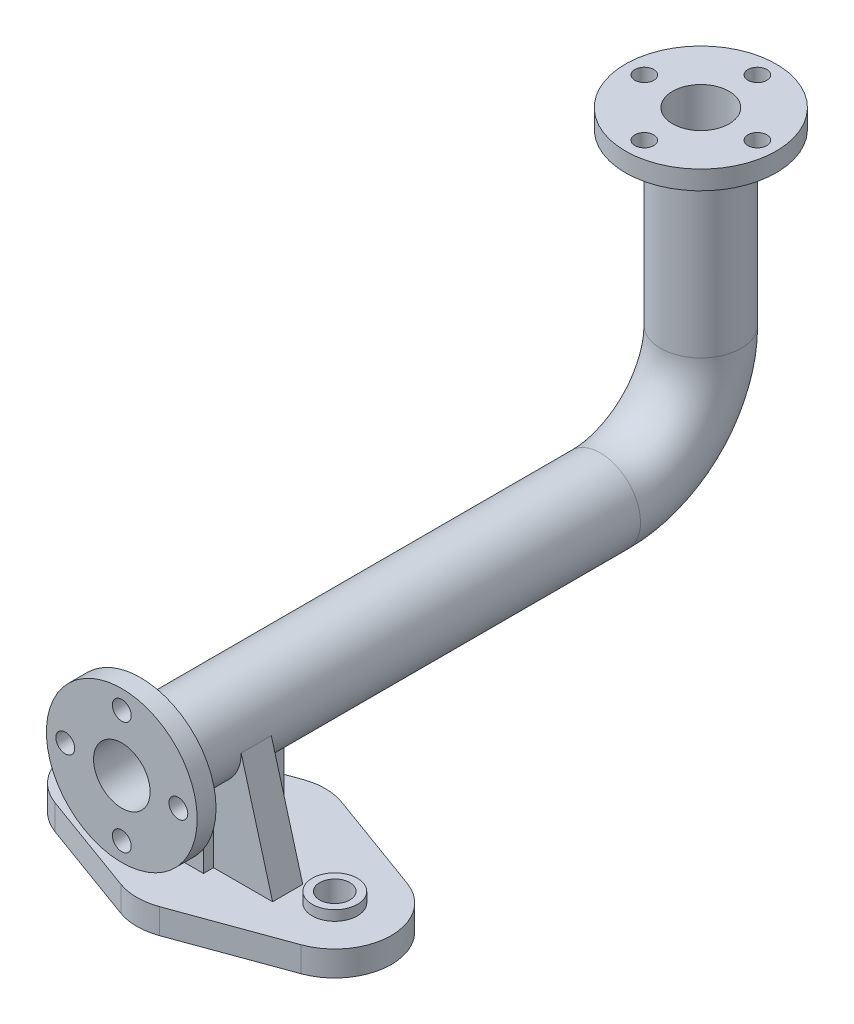
from build123d import *
from build123d.topology import SkipClean

# Parameters (mm, degrees)
SWEEP_THIN1_PROFILE_R   = 32
SWEEP_THIN1_PROFILE_R_2 = 22.5
SKETCH16_R              = 60
SKETCH16_R_2            = 7.5
SKETCH16_R_3            = 22.5
BOSS_EXTRUDE1_DEPTH     = 15
BOSS_EXTRUDE2_START     = 15
SKETCH17_R              = 60
SKETCH17_R_2            = 22.5
SKETCH17_R_3            = 7.5
BOSS_EXTRUDE2_DEPTH     = 15
SKETCH24_R              = 12
BOSS_EXTRUDE3_DEPTH     = 20
EXTRUDE_THIN1_REACH     = 577.336
SKETCH26_W              = 20
SKETCH26_H              = 64
RIB1_REACH              = 568.248
SKETCH27_WALL_W         = 1227.903575826
SKETCH27_WALL_H         = 24
SKETCH28_R              = 18
SKETCH28_R_2            = 12
BOSS_EXTRUDE4_DEPTH     = 8


with BuildPart() as part:
    # Sweep-Thin1: sweep along a path in Sketch1
    with BuildLine(Plane(origin=(0, 0, 0), x_dir=(0, 0, -1), z_dir=(1, 0, 0))) as sweep_thin1_path:
        Line((0, 0), (0, -135))
        ThreePointArc((0, -135), (-23.431457505, -191.568542495), (-80, -215))
        Line((-80, -215), (-445.82, -215))
    # Sweep-Thin1 profile (on start of the path) → Sweep-Thin1 (sweep)
    with BuildSketch(Plane(origin=(0, 0, 0), x_dir=(0, 0, -1), z_dir=(0, -1, 0))):
        Circle(SWEEP_THIN1_PROFILE_R)
        Circle(SWEEP_THIN1_PROFILE_R_2, mode=Mode.SUBTRACT)
    sweep(path=sweep_thin1_path.line)

    # Sketch16 → Boss-Extrude1 (add)
    with SkipClean():  # the faces are left unmerged after this step: merging them gives an invalid solid
        with BuildSketch(Plane(origin=(0, 0, 0), x_dir=(1, 0, 0), z_dir=(0, 1, 0))):
            Circle(SKETCH16_R)
            with Locations((0, -45)):
                Circle(SKETCH16_R_2, mode=Mode.SUBTRACT)
            with Locations((-45, 0)):
                Circle(SKETCH16_R_2, mode=Mode.SUBTRACT)
            with Locations((0, 45)):
                Circle(SKETCH16_R_2, mode=Mode.SUBTRACT)
            with Locations((45, 0)):
                Circle(SKETCH16_R_2, mode=Mode.SUBTRACT)
            Circle(SKETCH16_R_3, mode=Mode.SUBTRACT)
        extrude(amount=BOSS_EXTRUDE1_DEPTH)

    # Sketch17 → Boss-Extrude2 (add)
    with SkipClean():  # the faces are left unmerged after this step: merging them gives an invalid solid
        with BuildSketch(Plane.XY.offset(445.82).offset(BOSS_EXTRUDE2_START)):
            with Locations((0, -215)):
                Circle(SKETCH17_R)
            with Locations((0, -215)):
                Circle(SKETCH17_R_2, mode=Mode.SUBTRACT)
            with Locations((0, -260)):
                Circle(SKETCH17_R_3, mode=Mode.SUBTRACT)
            with Locations((-45, -215)):
                Circle(SKETCH17_R_3, mode=Mode.SUBTRACT)
            with Locations((45, -215)):
                Circle(SKETCH17_R_3, mode=Mode.SUBTRACT)
            with Locations((0, -170)):
                Circle(SKETCH17_R_3, mode=Mode.SUBTRACT)
        extrude(amount=-BOSS_EXTRUDE2_DEPTH)

    # Sketch26 → Extrude-Thin1 (add, up to next)
    with BuildSketch(Plane(origin=(0, -305, 0), x_dir=(1, 0, 0), z_dir=(0, 1, 0)), mode=Mode.PRIVATE) as extrude_thin1_sk1:
        with Locations((0, -373.82)):
            Rectangle(SKETCH26_W, SKETCH26_H)
    extrude_thin1_tool1 = extrude(extrude_thin1_sk1.sketch, amount=EXTRUDE_THIN1_REACH, mode=Mode.PRIVATE) - part.part


with BuildPart() as body_2:
    # Sketch24 → Boss-Extrude3 (new body)
    with BuildSketch(Plane(origin=(0, -325, 0), x_dir=(1, 0, 0), z_dir=(0, 1, 0))):
        with BuildLine():
            Line((15.39090645, -446.133712262), (97.89090645, -416.106167935))
            ThreePointArc((97.89090645, -416.106167935), (127.5, -373.82), (97.89090645, -331.533832065))
            Line((97.89090645, -331.533832065), (15.39090645, -301.506287738))
            ThreePointArc((15.39090645, -301.506287738), (0, -298.792455673), (-15.39090645, -301.506287738))
            Line((-15.39090645, -301.506287738), (-97.89090645, -331.533832065))
            ThreePointArc((-97.89090645, -331.533832065), (-127.5, -373.82), (-97.89090645, -416.106167935))
            Line((-97.89090645, -416.106167935), (-15.39090645, -446.133712262))
            ThreePointArc((-15.39090645, -446.133712262), (0, -448.847544327), (15.39090645, -446.133712262))
        make_face()
        with Locations((-82.5, -373.82)):
            Circle(SKETCH24_R, mode=Mode.SUBTRACT)
        with Locations((82.5, -373.82)):
            Circle(SKETCH24_R, mode=Mode.SUBTRACT)
    extrude(amount=BOSS_EXTRUDE3_DEPTH)


with BuildPart() as part_1:
    add(part.part)

    add(body_2.part)  # Extrude-Thin1 merges body 2
    add(extrude_thin1_tool1.solids().sort_by_distance((0, -305, 373.82))[0])

    # Sketch27 wall → Rib1 (add, up to next)
    with BuildSketch(Plane(origin=(44.5, -260, 385.82), x_dir=(-0.267643863786, 0.96351790963, 0), z_dir=(0.96351790963, 0.267643863786, 0)), mode=Mode.PRIVATE) as rib1_sk1:
        Rectangle(SKETCH27_WALL_W, SKETCH27_WALL_H)
    rib1_tool1 = extrude(rib1_sk1.sketch, amount=-RIB1_REACH, mode=Mode.PRIVATE) - part_1.part
    rib1 = rib1_tool1.solids().sort_by_distance((44.5, -260, 385.82))[0]
    add(rib1)

    # Mirror3: Rib1 across plane
    with SkipClean():  # the faces are left unmerged after this step: merging them gives an invalid solid
        add(rib1.mirror(Plane(origin=(0, 0, 0), x_dir=(0, 0, 1), z_dir=(1, 0, 0))))

    # Sketch28 → Boss-Extrude4 (add)
    # profile 1 of 2: a face of its own
    with SkipClean():  # the faces are left unmerged after this step: merging them gives an invalid solid
        with BuildSketch(Plane(origin=(0, -305, 0), x_dir=(1, 0, 0), z_dir=(0, 1, 0))):
            with Locations((-82.5, -373.82)):
                Circle(SKETCH28_R)
            with Locations((-82.5, -373.82)):
                Circle(SKETCH28_R_2, mode=Mode.SUBTRACT)
        # profile 2 of 2: a face of its own
        with BuildSketch(Plane(origin=(0, -305, 0), x_dir=(1, 0, 0), z_dir=(0, 1, 0))):
            with Locations((82.5, -373.82)):
                Circle(SKETCH28_R)
            with Locations((82.5, -373.82)):
                Circle(SKETCH28_R_2, mode=Mode.SUBTRACT)
        extrude(amount=BOSS_EXTRUDE4_DEPTH)


solid = part_1.part
